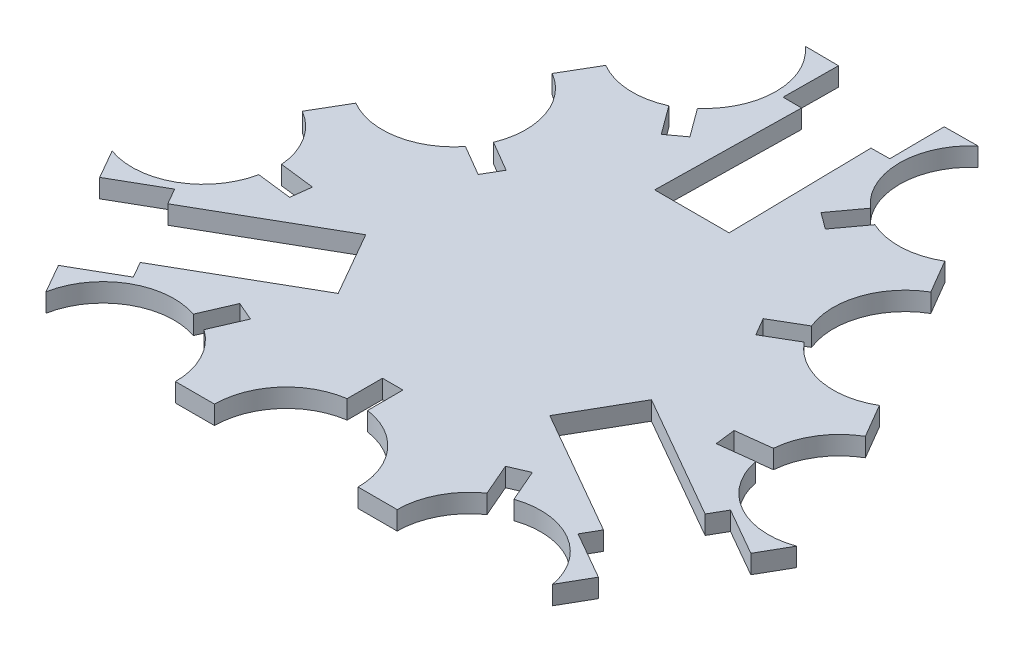
from build123d import *

# Parameters (mm, degrees)
BOSS_EXTRU_1_DEPTH = 10


with BuildPart() as part:
    # Esquisse2 → Boss.-Extru.1 (new body)
    with BuildSketch(Plane(origin=(0, 0, 0), x_dir=(1, 0, 0), z_dir=(0, 1, 0))):
        with BuildLine():
            Line((36.413113552, 132.966619465), (76.413113552, 132.966619465))
            Line((76.413113552, 132.966619465), (75.069459937, 210.531035708))
            Line((75.069459937, 210.531035708), (85.069084249, 210.617716914))
            Line((85.069084249, 210.617716914), (84.813374692, 240.116608632))
            Line((84.813374692, 240.116608632), (102.812698453, 240.272634802))
            ThreePointArc((102.812698453, 240.272634802), (89.604268477, 211.329810699), (102.868184053, 182.412372481))
            Line((102.868184053, 182.412372481), (91.624672702, 167.096255072))
            Line((91.624672702, 167.096255072), (100.49189857, 160.586853763))
            Line((100.49189857, 160.586853763), (111.735409922, 175.902971172))
            ThreePointArc((111.735409922, 175.902971172), (129.846153012, 172.469977356), (147.507194899, 177.749377064))
            Line((147.507194899, 177.749377064), (158.112115685, 159.623824517))
            ThreePointArc((158.112115685, 159.623824517), (141.072313982, 138.74483792), (141.863284971, 111.806736869))
            Line((141.863284971, 111.806736869), (125.463975524, 102.211808539))
            Line((125.463975524, 102.211808539), (131.01893403, 92.717471491))
            Line((131.01893403, 92.717471491), (147.418243478, 102.312399821))
            ThreePointArc((147.418243478, 102.312399821), (170.51388989, 88.424345956), (197.063848919, 93.048910681))
            Line((197.063848919, 93.048910681), (207.668769705, 74.923358135))
            ThreePointArc((207.668769705, 74.923358135), (194.413310744, 62.114093146), (188.532513668, 44.644099226))
            Line((188.532513668, 44.644099226), (169.671901636, 42.346858754))
            Line((169.671901636, 42.346858754), (171.001882962, 31.427557051))
            Line((171.001882962, 31.427557051), (189.862494994, 33.724797523))
            ThreePointArc((189.862494994, 33.724797523), (208.572406926, 7.993709614), (240.274776322, 5.32735176))
            Line((240.274776322, 5.32735176), (231.319855268, -10.287045088))
            Line((231.319855268, -10.287045088), (205.729593768, 4.389075528))
            Line((205.729593768, 4.389075528), (200.754637626, -4.285589387))
            Line((200.754637626, -4.285589387), (133.168524557, 34.475325478))
            Line((133.168524557, 34.475325478), (113.268699993, -0.223334184))
            Line((113.268699993, -0.223334184), (180.854813062, -38.984249048))
            Line((180.854813062, -38.984249048), (175.879856921, -47.658913964))
            Line((175.879856921, -47.658913964), (201.470118422, -62.33503458))
            Line((201.470118422, -62.33503458), (192.515197368, -77.949431428))
            ThreePointArc((192.515197368, -77.949431428), (174.204229484, -51.93293388), (142.546738059, -48.778108028))
            Line((142.546738059, -48.778108028), (135.004997884, -31.339009567))
            Line((135.004997884, -31.339009567), (124.908677722, -35.705280195))
            Line((124.908677722, -35.705280195), (132.450417897, -53.144378656))
            ThreePointArc((132.450417897, -53.144378656), (120.34147001, -67.042502374), (115.979474134, -84.952205157))
            Line((115.979474134, -84.952205157), (94.979474134, -84.952205157))
            ThreePointArc((94.979474134, -84.952205157), (85.563406447, -59.700975629), (61.913113552, -46.780040317))
            Line((61.913113552, -46.780040317), (61.913113552, -27.780040317))
            Line((61.913113552, -27.780040317), (50.913113552, -27.780040317))
            Line((50.913113552, -27.780040317), (50.913113552, -46.780040317))
            ThreePointArc((50.913113552, -46.780040317), (27.262820657, -59.700975629), (17.84675297, -84.952205157))
            Line((17.84675297, -84.952205157), (-3.15324703, -84.952205157))
            ThreePointArc((-3.15324703, -84.952205157), (-7.515242906, -67.042502374), (-19.624190793, -53.144378656))
            Line((-19.624190793, -53.144378656), (-12.082450618, -35.705280195))
            Line((-12.082450618, -35.705280195), (-22.17877078, -31.339009567))
            Line((-22.17877078, -31.339009567), (-29.720510955, -48.778108028))
            ThreePointArc((-29.720510955, -48.778108028), (-61.37800238, -51.93293388), (-79.688970264, -77.949431428))
            Line((-79.688970264, -77.949431428), (-88.643891318, -62.33503458))
            Line((-88.643891318, -62.33503458), (-63.053629817, -47.658913964))
            Line((-63.053629817, -47.658913964), (-68.028585958, -38.984249048))
            Line((-68.028585958, -38.984249048), (-0.442472889, -0.223334184))
            Line((-0.442472889, -0.223334184), (-20.342297454, 34.475325478))
            Line((-20.342297454, 34.475325478), (-87.928410523, -4.285589387))
            Line((-87.928410523, -4.285589387), (-92.903366664, 4.389075528))
            Line((-92.903366664, 4.389075528), (-118.493628164, -10.287045088))
            Line((-118.493628164, -10.287045088), (-127.448549218, 5.32735176))
            ThreePointArc((-127.448549218, 5.32735176), (-95.746179823, 7.993709614), (-77.03626789, 33.724797523))
            Line((-77.03626789, 33.724797523), (-58.175655858, 31.427557051))
            Line((-58.175655858, 31.427557051), (-56.845674532, 42.346858754))
            Line((-56.845674532, 42.346858754), (-75.706286564, 44.644099226))
            ThreePointArc((-75.706286564, 44.644099226), (-81.58708364, 62.114093146), (-94.842542601, 74.923358135))
            Line((-94.842542601, 74.923358135), (-84.237621815, 93.048910681))
            ThreePointArc((-84.237621815, 93.048910681), (-57.687662786, 88.424345956), (-34.592016374, 102.312399821))
            Line((-34.592016374, 102.312399821), (-18.192706927, 92.717471491))
            Line((-18.192706927, 92.717471491), (-12.63774842, 102.211808539))
            Line((-12.63774842, 102.211808539), (-29.037057867, 111.806736869))
            ThreePointArc((-29.037057867, 111.806736869), (-28.246086878, 138.74483792), (-45.285888581, 159.623824517))
            Line((-45.285888581, 159.623824517), (-34.680967795, 177.749377064))
            ThreePointArc((-34.680967795, 177.749377064), (-17.019925908, 172.469977356), (1.090817182, 175.902971172))
            Line((1.090817182, 175.902971172), (12.334328534, 160.586853763))
            Line((12.334328534, 160.586853763), (21.201554402, 167.096255072))
            Line((21.201554402, 167.096255072), (9.95804305, 182.412372481))
            ThreePointArc((9.95804305, 182.412372481), (23.221958626, 211.329810699), (10.013528651, 240.272634802))
            Line((10.013528651, 240.272634802), (28.012852411, 240.116608632))
            Line((28.012852411, 240.116608632), (27.757142855, 210.617716914))
            Line((27.757142855, 210.617716914), (37.756767167, 210.531035708))
            Line((37.756767167, 210.531035708), (36.413113552, 132.966619465))
        make_face()
    extrude(amount=BOSS_EXTRU_1_DEPTH)


solid = part.part
